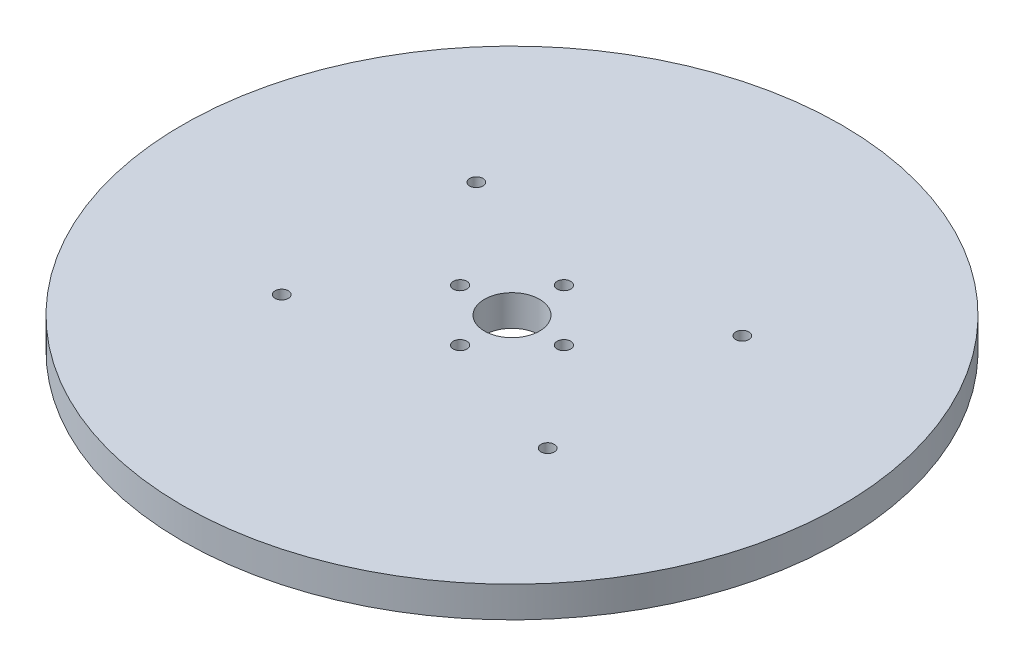
from build123d import *

# Parameters (mm, degrees)
SKETCH1_R           = 50.8
BOSS_EXTRUDE1_DEPTH = 4.7625
SKETCH2_R           = 1.05
CUT_EXTRUDE1_DEPTH  = 72.999731987
SKETCH3_R           = 4.25
CUT_EXTRUDE2_DEPTH  = 72.999731987
SKETCH4_R           = 1.025
CUT_EXTRUDE3_DEPTH  = 72.999731987
SKETCH6_R           = 15
BOSS_EXTRUDE2_DEPTH = 1.5875


with BuildPart() as part:
    # Sketch1 → Boss-Extrude1 (new body)
    with BuildSketch(Plane(origin=(0, 0, 0), x_dir=(1, 0, 0), z_dir=(0, 1, 0))):
        with Locations(Location((0, 0, 0), (0, 0, 90))):
            Circle(SKETCH1_R)
    extrude(amount=BOSS_EXTRUDE1_DEPTH)

    # Sketch2 → Cut-Extrude1 (cut, through all)
    with BuildSketch(Plane(origin=(0, 4.7625, 0), x_dir=(-1, 0, 0), z_dir=(0, 1, 0))):
        with Locations(Location((0, 8, 0), (0, 0, 90))):
            Circle(SKETCH2_R)
        with Locations(Location((-8, 0, 0), (0, 0, 90))):
            Circle(SKETCH2_R)
        with Locations(Location((0, -8, 0), (0, 0, 90))):
            Circle(SKETCH2_R)
        with Locations(Location((8, 0, 0), (0, 0, 90))):
            Circle(SKETCH2_R)
    extrude(amount=-CUT_EXTRUDE1_DEPTH, mode=Mode.SUBTRACT)

    # Sketch3 → Cut-Extrude2 (cut, through all)
    with BuildSketch(Plane(origin=(0, 4.7625, 0), x_dir=(-1, 0, 0), z_dir=(0, 1, 0))):
        with Locations(Location((0, 0, 0), (0, 0, 90))):
            Circle(SKETCH3_R)
    extrude(amount=-CUT_EXTRUDE2_DEPTH, mode=Mode.SUBTRACT)

    # Sketch4 → Cut-Extrude3 (cut, through all)
    with BuildSketch(Plane(origin=(0, 4.7625, 0), x_dir=(-1, 0, 0), z_dir=(0, 1, 0))):
        with Locations(Location((-20.5, 15, 0), (0, 0, 90))):
            Circle(SKETCH4_R)
        with Locations(Location((20.5, 15, 0), (0, 0, 90))):
            Circle(SKETCH4_R)
        with Locations(Location((20.5, -15, 0), (0, 0, 90))):
            Circle(SKETCH4_R)
        with Locations(Location((-20.5, -15, 0), (0, 0, 90))):
            Circle(SKETCH4_R)
    extrude(amount=-CUT_EXTRUDE3_DEPTH, mode=Mode.SUBTRACT)


with BuildPart() as body_2:
    # Sketch6 → Boss-Extrude2 (new body)
    with BuildSketch(Plane.XZ):
        with BuildLine():
            ThreePointArc((-13.129796139, 16.389278609), (-26.552727442, 19.428824958), (-19.593954345, 7.554929062))
            ThreePointArc((-19.593954345, 7.554929062), (-21, 0), (-19.593954345, -7.554929062))
            ThreePointArc((-19.593954345, -7.554929062), (-26.552727442, -19.428824958), (-13.129796139, -16.389278609))
            ThreePointArc((-13.129796139, -16.389278609), (0, -21), (13.129796139, -16.389278609))
            ThreePointArc((13.129796139, -16.389278609), (26.552727442, -19.428824958), (19.593954345, -7.554929062))
            ThreePointArc((19.593954345, -7.554929062), (21, 0), (19.593954345, 7.554929062))
            ThreePointArc((19.593954345, 7.554929062), (26.552727442, 19.428824958), (13.129796139, 16.389278609))
            ThreePointArc((13.129796139, 16.389278609), (0, 21), (-13.129796139, 16.389278609))
        make_face()
        with Locations(Location((0, 0, 0), (0, 0, 270))):
            Circle(SKETCH6_R, mode=Mode.SUBTRACT)
        Polygon((-17.642116168, 15), (-19.071058084, 17.475), (-21.928941916, 17.475), (-23.357883832, 15), (-21.928941916, 12.525), (-19.071058084, 12.525), align=None, mode=Mode.SUBTRACT)
        Polygon((21.928941916, 17.475), (19.071058084, 17.475), (17.642116168, 15), (19.071058084, 12.525), (21.928941916, 12.525), (23.357883832, 15), align=None, mode=Mode.SUBTRACT)
        Polygon((21.928941916, -12.525), (19.071058084, -12.525), (17.642116168, -15), (19.071058084, -17.475), (21.928941916, -17.475), (23.357883832, -15), align=None, mode=Mode.SUBTRACT)
        Polygon((-21.928941916, -12.525), (-23.357883832, -15), (-21.928941916, -17.475), (-19.071058084, -17.475), (-17.642116168, -15), (-19.071058084, -12.525), align=None, mode=Mode.SUBTRACT)
    extrude(amount=BOSS_EXTRUDE2_DEPTH)


solid = Compound([part.part, body_2.part])
